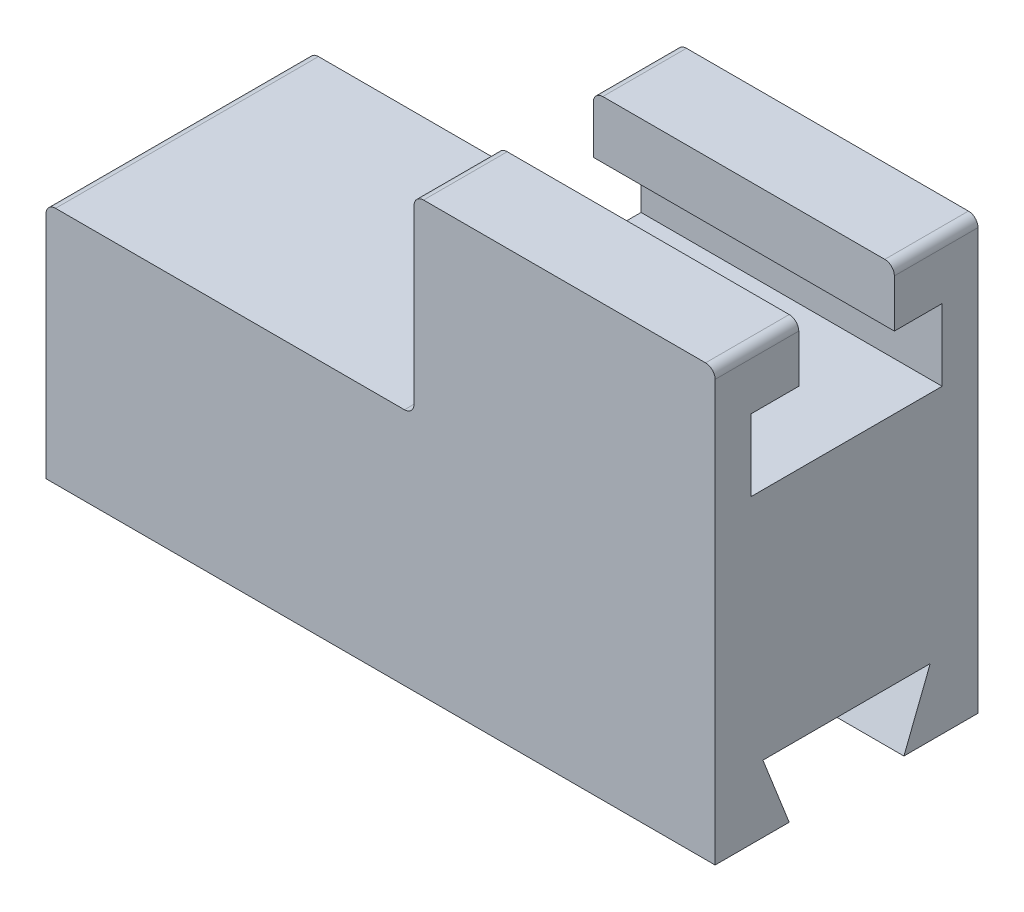
from build123d import *

# Parameters (mm, degrees)
BOSS_EXTRUDE1_DEPTH = 27.5
CUT_EXTRUDE1_DEPTH  = 169.689804078
CUT_EXTRUDE2_DEPTH  = 63
SKETCH7_R           = 8
FILLET1_R           = 2
FILLET2_R           = 2


with BuildPart() as part:
    # Sketch1 → Boss-Extrude1 (new, symmetric)
    with BuildSketch(Plane.XY):
        Polygon((-70, 0), (70, 0), (70, 90), (7, 90), (7, 50), (-70, 50), align=None)
    extrude(amount=BOSS_EXTRUDE1_DEPTH, both=True)

    # Sketch3 → Cut-Extrude1 (cut, through all)
    with BuildSketch(Plane.ZY.offset(70)):
        Polygon((-12, 0), (-17.5, 14), (17.5, 14), (12, 0), align=None)
    extrude(amount=-CUT_EXTRUDE1_DEPTH, mode=Mode.SUBTRACT)

    # Sketch5 → Cut-Extrude2 (cut)
    with BuildSketch(Plane(origin=(70, 0, 0), x_dir=(0, 0, -1), z_dir=(1, 0, 0))):
        Polygon((-10, 90), (-10, 78), (-20, 78), (-20, 63), (20, 63), (20, 78), (10, 78), (10, 90), align=None)
    extrude(amount=-CUT_EXTRUDE2_DEPTH, mode=Mode.SUBTRACT)

    # Cut-Sweep2: sweep along a path in Sketch6
    with BuildLine(Plane.XY) as cut_sweep2_path:
        Line((-30, 14), (-30, 20))
        ThreePointArc((-30, 20), (-27.071067812, 27.071067812), (-20, 30))
        Line((-20, 30), (28.5, 30))
        ThreePointArc((28.5, 30), (35.571067812, 32.928932188), (38.5, 40))
        Line((38.5, 40), (38.5, 63))
    # Sketch7 → Cut-Sweep2 (sweep, cut)
    with BuildSketch(Plane(origin=(38.5, 63, 0), x_dir=(1, 0, 0), z_dir=(0, 1, 0))):
        with Locations((0.219622083, 0)):
            Circle(SKETCH7_R)
    sweep(path=cut_sweep2_path.line, mode=Mode.SUBTRACT)

    # Fillet1
    fillet1_edges = [part.edges().sort_by_distance(p)[0] for p in [
        (-70, 50, 0),
        (7, 50, 0),
        (7, 90, 18.75),
        (7, 90, -18.75),
    ]]
    fillet(fillet1_edges, radius=FILLET1_R)

    # Fillet2
    fillet2_edges = [part.edges().sort_by_distance(p)[0] for p in [
        (70, 90, 18.75),
        (70, 90, -18.75),
    ]]
    fillet(fillet2_edges, radius=FILLET2_R)


solid = part.part
